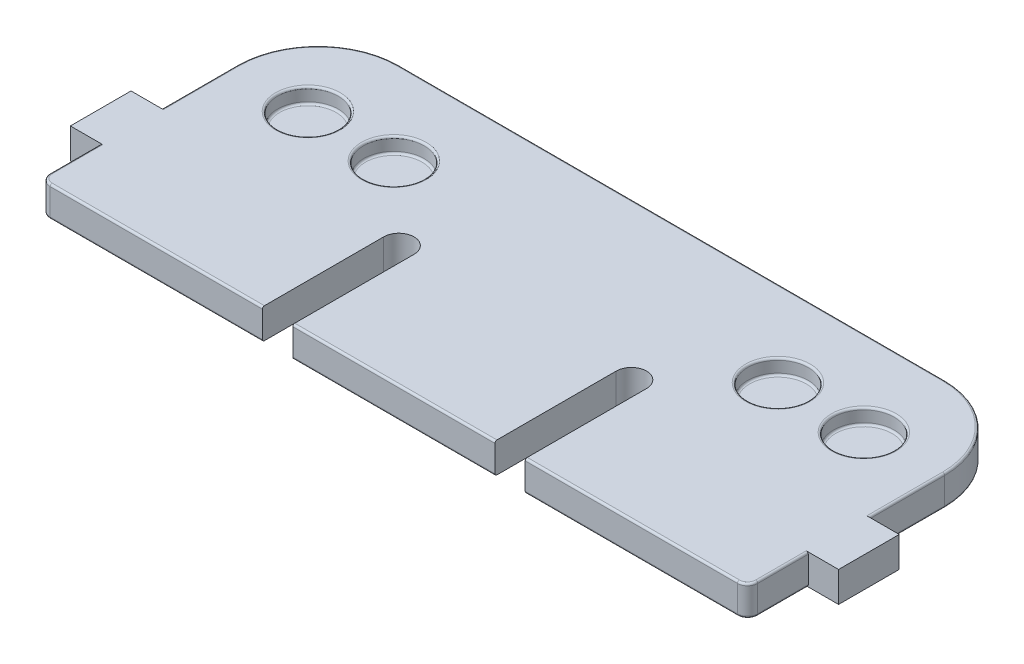
from build123d import *

# Parameters (mm, degrees)
BOSS_EXTRUDE1_DEPTH = 3
SKETCH2_R           = 3
CUT_EXTRUDE1_DEPTH  = 1.5
FILLET1_R           = 0.2


with BuildPart() as part:
    # Sketch1 → Boss-Extrude1 (new body)
    with BuildSketch(Plane(origin=(0, 0, 0), x_dir=(1, 0, 0), z_dir=(0, 1, 0))):
        with BuildLine():
            Line((-10, 12), (-10, 0))
            Line((-10, 0), (10, 0))
            Line((10, 0), (10, 12))
            ThreePointArc((10, 12), (11.5, 13.5), (13, 12))
            Line((13, 12), (13, 0))
            Line((13, 0), (34, 0))
            ThreePointArc((34, 0), (34.707106781, 0.292893219), (35, 1))
            Line((35, 1), (35, 6))
            Line((35, 6), (38, 6))
            Line((38, 6), (38, 12))
            Line((38, 12), (35, 12))
            Line((35, 12), (35, 19.5))
            ThreePointArc((35, 19.5), (32.656854249, 25.156854249), (27, 27.5))
            Line((27, 27.5), (-27, 27.5))
            ThreePointArc((-27, 27.5), (-32.656854249, 25.156854249), (-35, 19.5))
            Line((-35, 19.5), (-35, 12))
            Line((-35, 12), (-38, 12))
            Line((-38, 12), (-38, 6))
            Line((-38, 6), (-35, 6))
            Line((-35, 6), (-35, 1))
            ThreePointArc((-35, 1), (-34.707106781, 0.292893219), (-34, 0))
            Line((-34, 0), (-13, 0))
            Line((-13, 0), (-13, 12))
            ThreePointArc((-13, 12), (-11.5, 13.5), (-10, 12))
        make_face()
    extrude(amount=BOSS_EXTRUDE1_DEPTH)

    # Sketch2 → Cut-Extrude1 (cut)
    with BuildSketch(Plane(origin=(0, 3, 0), x_dir=(1, 0, 0), z_dir=(0, 1, 0))):
        with Locations(Location((-27.5, 19, 0), (0, 0, 270))):
            Circle(SKETCH2_R)
        with Locations(Location((-19, 19, 0), (0, 0, 270))):
            Circle(SKETCH2_R)
        with Locations(Location((19, 19, 0), (0, 0, 90))):
            Circle(SKETCH2_R)
        with Locations(Location((27.5, 19, 0), (0, 0, 90))):
            Circle(SKETCH2_R)
    extrude(amount=-CUT_EXTRUDE1_DEPTH, mode=Mode.SUBTRACT)

    # Fillet1
    fillet1_edges = [part.edges().sort_by_distance(p)[0] for p in [
        (-35, 3, -3.5),
        (0, 0, -27.5),
        (32.656854249, 0, -25.156854249),
        (35, 0, -15.75),
        (-34.707106781, 3, -0.292893219),
        (35, 0, -3.5),
        (34.707106781, 0, -0.292893219),
        (23.5, 0, 0),
        (-23.5, 3, 0),
        (0, 0, 0),
        (-23.5, 0, 0),
        (-34.707106781, 0, -0.292893219),
        (-35, 0, -3.5),
        (-35, 0, -15.75),
        (-32.656854249, 0, -25.156854249),
        (0, 3, 0),
        (-32.656854249, 3, -25.156854249),
        (23.5, 3, 0),
        (34.707106781, 3, -0.292893219),
        (35, 3, -3.5),
        (-27.5, 1.5, -22),
        (-27.5, 3, -22),
        (35, 3, -15.75),
        (-19, 1.5, -22),
        (-19, 3, -22),
        (-35, 3, -15.75),
        (32.656854249, 3, -25.156854249),
        (19, 1.5, -16),
        (19, 3, -16),
        (0, 3, -27.5),
        (27.5, 1.5, -16),
        (27.5, 3, -16),
    ]]
    fillet(fillet1_edges, radius=FILLET1_R)


solid = part.part
